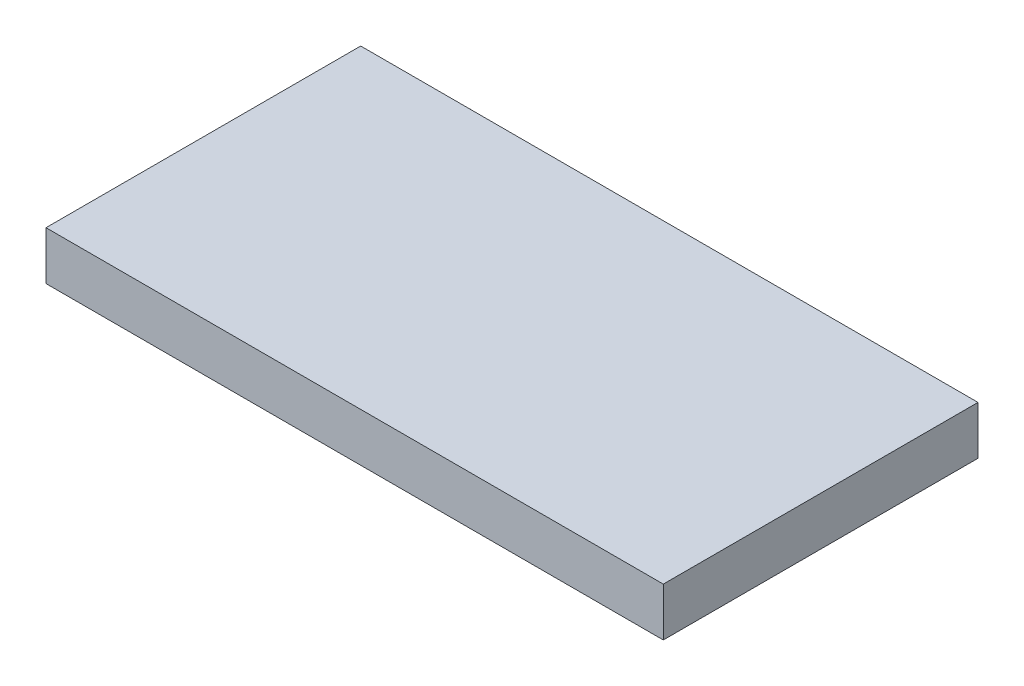
from build123d import *

# Parameters (mm, degrees)
SKETCH_1_W      = 51
SKETCH_1_H      = 26
EXTRUDE_1_DEPTH = 4


with BuildPart() as part:
    # Эскиз1 → Бобышка-Вытянуть1 (new body)
    with BuildSketch(Plane(origin=(0, 0, 0), x_dir=(1, 0, 0), z_dir=(0, 1, 0))):
        with Locations((25.5, 13)):
            Rectangle(SKETCH_1_W, SKETCH_1_H)
    extrude(amount=EXTRUDE_1_DEPTH)


solid = part.part
